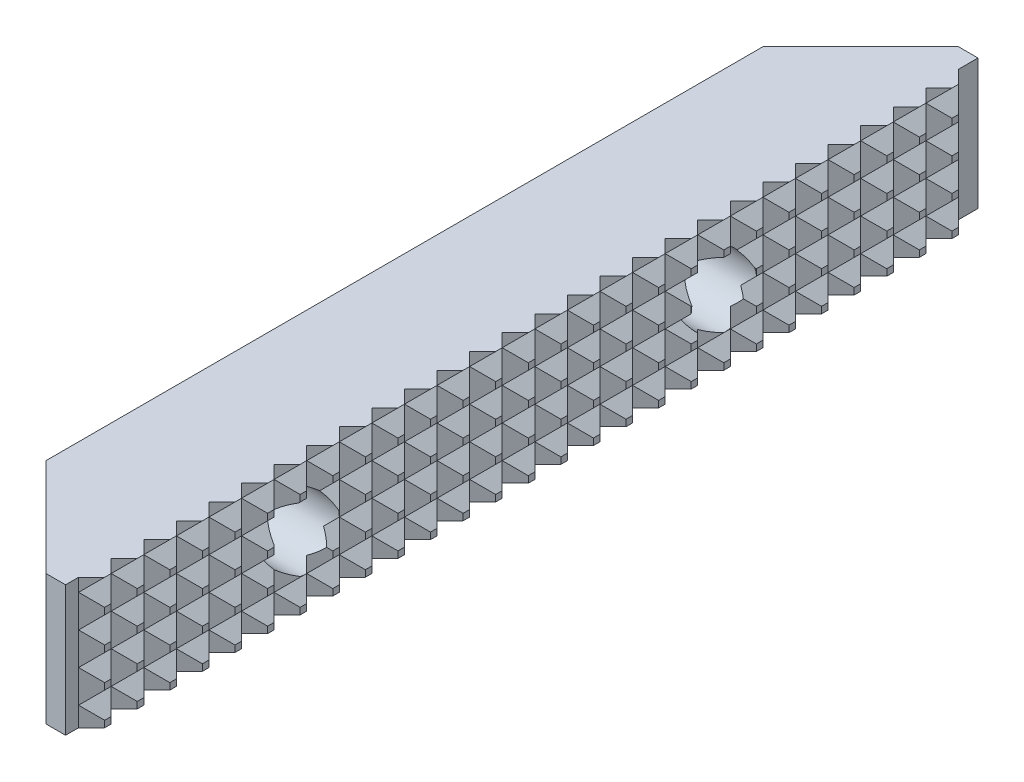
from build123d import *

# Parameters (mm, degrees)
SKIZZE1_W                       = 10
SKIZZE1_H                       = 10
AUFSATZ_LINEAR_AUSTRAGEN1_DEPTH = 70
SKIZZE2_R                       = 1.5
SCHNITT_LINEAR_AUSTRAGEN1_DEPTH = 70
SCHNITT_LINEAR_AUSTRAGEN2_DEPTH = 71.356236397
LINEARES_MUSTER1_COUNT          = 4
LINEARES_MUSTER1_PITCH          = 2.5
SCHNITT_LINEAR_AUSTRAGEN3_DEPTH = 71.887234394
LINEARES_MUSTER2_COUNT          = 28
LINEARES_MUSTER2_PITCH          = 2.5
SKIZZE6_R                       = 2.5
SCHNITT_LINEAR_AUSTRAGEN4_DEPTH = 5
SKIZZE7_W                       = 2.357520654
SKIZZE7_H                       = 2.200753805
SKIZZE7_W_2                     = 1.178760327
SKIZZE7_H_2                     = 1.772879687
SCHNITT_LINEAR_AUSTRAGEN5_DEPTH = 71.887234394
FASE1_SIZE                      = 7.5


with BuildPart() as part:
    # Skizze1 → Aufsatz-Linear austragen1 (new body)
    with BuildSketch(Plane.XY):
        Rectangle(SKIZZE1_W, SKIZZE1_H)
    extrude(amount=AUFSATZ_LINEAR_AUSTRAGEN1_DEPTH)

    # Skizze2 → Schnitt-Linear austragen1 (cut)
    with BuildSketch(Plane(origin=(5, 0, 0), x_dir=(0, 0, -1), z_dir=(1, 0, 0))):
        with Locations(Location((-52.5, 0, 0), (0, 0, 90))):
            Circle(SKIZZE2_R)
        with Locations(Location((-20.5, 0, 0), (0, 0, 90))):
            Circle(SKIZZE2_R)
    extrude(amount=-SCHNITT_LINEAR_AUSTRAGEN1_DEPTH, mode=Mode.SUBTRACT)

    # Skizze3 → Schnitt-Linear austragen2 (cut, symmetric)
    with BuildSketch(Plane.XY.offset(70)):
        Polygon((5, 5), (4, 4), (5, 3), align=None)
    schnitt_linear_austragen2 = extrude(amount=SCHNITT_LINEAR_AUSTRAGEN2_DEPTH, both=True, mode=Mode.SUBTRACT)

    # Lineares Muster1: Schnitt-Linear austragen2 ×4
    with Locations(*[(0, -i * LINEARES_MUSTER1_PITCH, 0) for i in range(1, LINEARES_MUSTER1_COUNT)]):
        add(schnitt_linear_austragen2, mode=Mode.SUBTRACT)

    # Skizze4 → Schnitt-Linear austragen3 (cut, symmetric)
    with BuildSketch(Plane(origin=(0, 5, 0), x_dir=(1, 0, 0), z_dir=(0, 1, 0))):
        Polygon((5, -70), (4, -69), (5, -68), align=None)
    schnitt_linear_austragen3 = extrude(amount=SCHNITT_LINEAR_AUSTRAGEN3_DEPTH, both=True, mode=Mode.SUBTRACT)

    # Lineares Muster2: Schnitt-Linear austragen3 ×28
    with Locations(*[(0, 0, -i * LINEARES_MUSTER2_PITCH) for i in range(1, LINEARES_MUSTER2_COUNT)]):
        add(schnitt_linear_austragen3, mode=Mode.SUBTRACT)

    # Skizze6 → Schnitt-Linear austragen4 (cut)
    with BuildSketch(Plane(origin=(5, 0, 0), x_dir=(0, 0, -1), z_dir=(1, 0, 0))):
        with Locations(Location((-52.5, 0, 0), (0, 0, 90))):
            Circle(SKIZZE6_R)
        with Locations(Location((-20.5, 0, 0), (0, 0, 90))):
            Circle(SKIZZE6_R)
    extrude(amount=-SCHNITT_LINEAR_AUSTRAGEN4_DEPTH, mode=Mode.SUBTRACT)

    # Skizze7 → Schnitt-Linear austragen5 (cut, through all)
    with BuildSketch(Plane.XZ.offset(5)):
        with Locations((5.178760327, 0.399623097)):
            Rectangle(SKIZZE7_W, SKIZZE7_H)
        with Locations((4.589380163, 69.886439843)):
            Rectangle(SKIZZE7_W_2, SKIZZE7_H_2)
    extrude(amount=-SCHNITT_LINEAR_AUSTRAGEN5_DEPTH, mode=Mode.SUBTRACT)

    # Fase1
    fase1_edges = [part.edges().sort_by_distance(p)[0] for p in [
        (-5, 0, 70),
        (-5, 0, 0),
    ]]
    chamfer(fase1_edges, length=FASE1_SIZE)


solid = part.part
